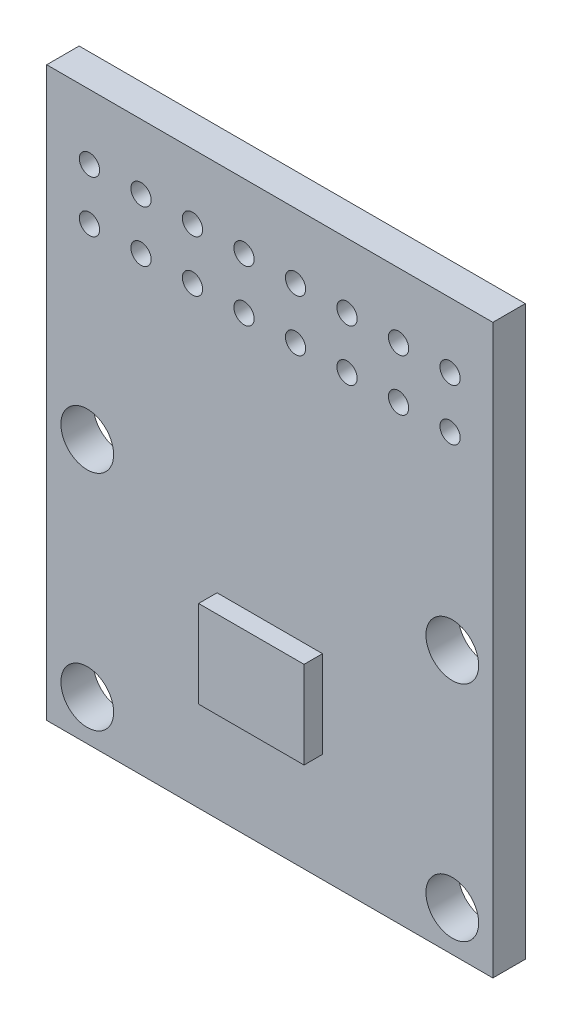
from build123d import *

# Parameters (mm, degrees)
SKETCH_1_W      = 22
SKETCH_1_H      = 28
SKETCH_1_R      = 1.3
SKETCH_1_R_2    = 0.5
EXTRUDE_1_DEPTH = 1.6
SKETCH_2_W      = 5.2
SKETCH_2_H      = 4.3
EXTRUDE_2_DEPTH = 0.91


with BuildPart() as part:
    # 草图1 → 凸台-拉伸1 (new body)
    with BuildSketch(Plane.XY):
        Rectangle(SKETCH_1_W, SKETCH_1_H)
        with Locations((-9, -1)):
            Circle(SKETCH_1_R, mode=Mode.SUBTRACT)
        with Locations((-9, -12)):
            Circle(SKETCH_1_R, mode=Mode.SUBTRACT)
        with Locations(Location((9, -12, 0), (0, 0, 180))):
            Circle(SKETCH_1_R, mode=Mode.SUBTRACT)
        with Locations(Location((9, -1, 0), (0, 0, 180))):
            Circle(SKETCH_1_R, mode=Mode.SUBTRACT)
        with Locations((-8.89, 10.8)):
            Circle(SKETCH_1_R_2, mode=Mode.SUBTRACT)
        with Locations((-6.35, 10.8)):
            Circle(SKETCH_1_R_2, mode=Mode.SUBTRACT)
        with Locations((-3.81, 10.8)):
            Circle(SKETCH_1_R_2, mode=Mode.SUBTRACT)
        with Locations((-1.27, 10.8)):
            Circle(SKETCH_1_R_2, mode=Mode.SUBTRACT)
        with Locations((1.27, 10.8)):
            Circle(SKETCH_1_R_2, mode=Mode.SUBTRACT)
        with Locations((3.81, 10.8)):
            Circle(SKETCH_1_R_2, mode=Mode.SUBTRACT)
        with Locations((6.35, 10.8)):
            Circle(SKETCH_1_R_2, mode=Mode.SUBTRACT)
        with Locations((8.89, 10.8)):
            Circle(SKETCH_1_R_2, mode=Mode.SUBTRACT)
        with Locations((-6.35, 8.26)):
            Circle(SKETCH_1_R_2, mode=Mode.SUBTRACT)
        with Locations((-3.81, 8.26)):
            Circle(SKETCH_1_R_2, mode=Mode.SUBTRACT)
        with Locations((-1.27, 8.26)):
            Circle(SKETCH_1_R_2, mode=Mode.SUBTRACT)
        with Locations((1.27, 8.26)):
            Circle(SKETCH_1_R_2, mode=Mode.SUBTRACT)
        with Locations((3.81, 8.26)):
            Circle(SKETCH_1_R_2, mode=Mode.SUBTRACT)
        with Locations((6.35, 8.26)):
            Circle(SKETCH_1_R_2, mode=Mode.SUBTRACT)
        with Locations((8.89, 8.26)):
            Circle(SKETCH_1_R_2, mode=Mode.SUBTRACT)
        with Locations((-8.89, 8.26)):
            Circle(SKETCH_1_R_2, mode=Mode.SUBTRACT)
    extrude(amount=EXTRUDE_1_DEPTH)

    # 草图2 → 凸台-拉伸2 (add)
    with BuildSketch(Plane.XY.offset(1.6)):
        with Locations((0, -6.5)):
            Rectangle(SKETCH_2_W, SKETCH_2_H)
    extrude(amount=EXTRUDE_2_DEPTH)


solid = part.part
